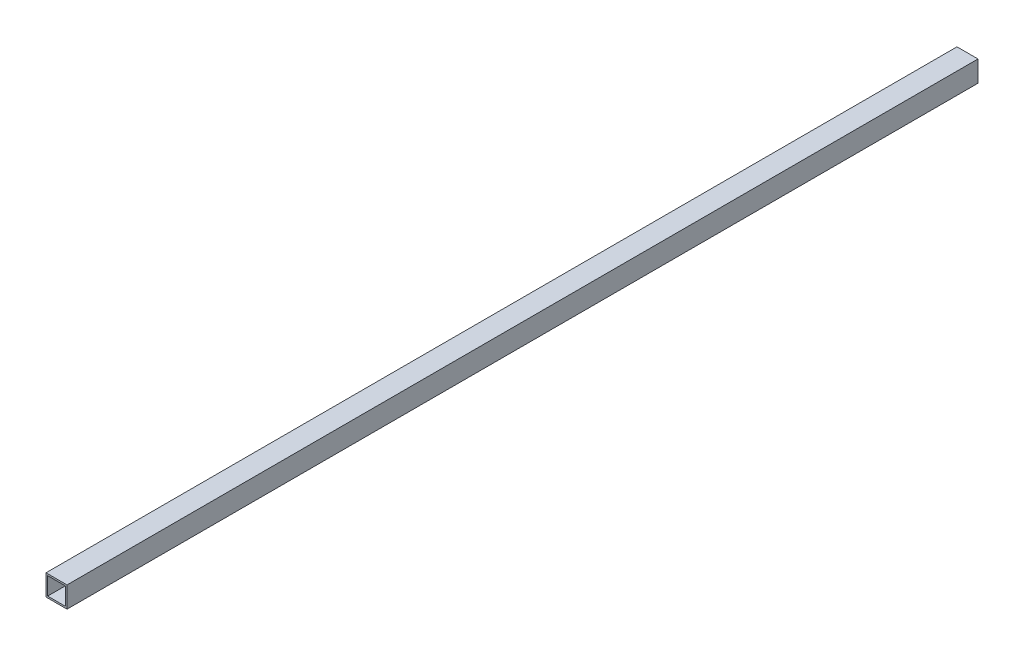
from build123d import *

# Parameters (mm, degrees)
SKETCH_1_W      = 15
SKETCH_1_H      = 15
SKETCH_1_W_2    = 12.6
SKETCH_1_H_2    = 12.6
EXTRUDE_1_DEPTH = 650


with BuildPart() as part:
    # 草图1 → 凸台-拉伸1 (new body)
    with BuildSketch(Plane.XY):
        Rectangle(SKETCH_1_W, SKETCH_1_H)
        Rectangle(SKETCH_1_W_2, SKETCH_1_H_2, mode=Mode.SUBTRACT)
    extrude(amount=EXTRUDE_1_DEPTH)


solid = part.part
